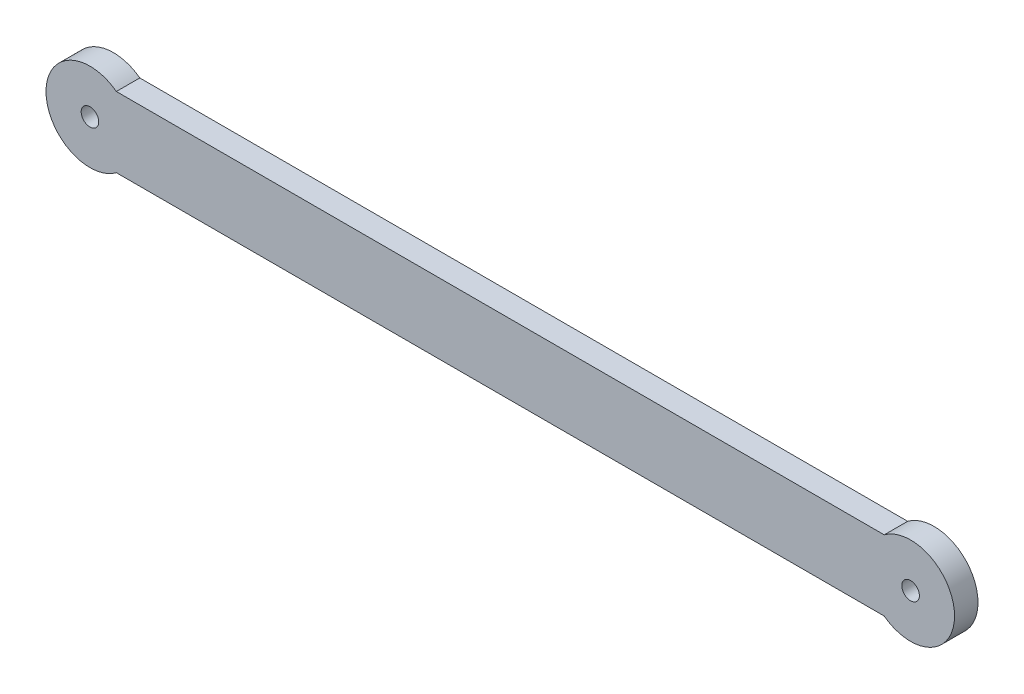
from build123d import *

# Parameters (mm, degrees)
SCHIZZO1_R                   = 1.5
ESTRUSIONE_ESTRUSIONE1_DEPTH = 4


with BuildPart() as part:
    # Schizzo1 → Estrusione-Estrusione1 (new body)
    with BuildSketch(Plane.XY):
        with BuildLine():
            Line((4.5, -6), (135.5, -6))
            ThreePointArc((135.5, -6), (147.5, 0), (135.5, 6))
            Line((135.5, 6), (4.5, 6))
            ThreePointArc((4.5, 6), (-7.5, 0), (4.5, -6))
        make_face()
        Circle(SCHIZZO1_R, mode=Mode.SUBTRACT)
        with Locations((140, 0)):
            Circle(SCHIZZO1_R, mode=Mode.SUBTRACT)
    extrude(amount=ESTRUSIONE_ESTRUSIONE1_DEPTH)


solid = part.part
